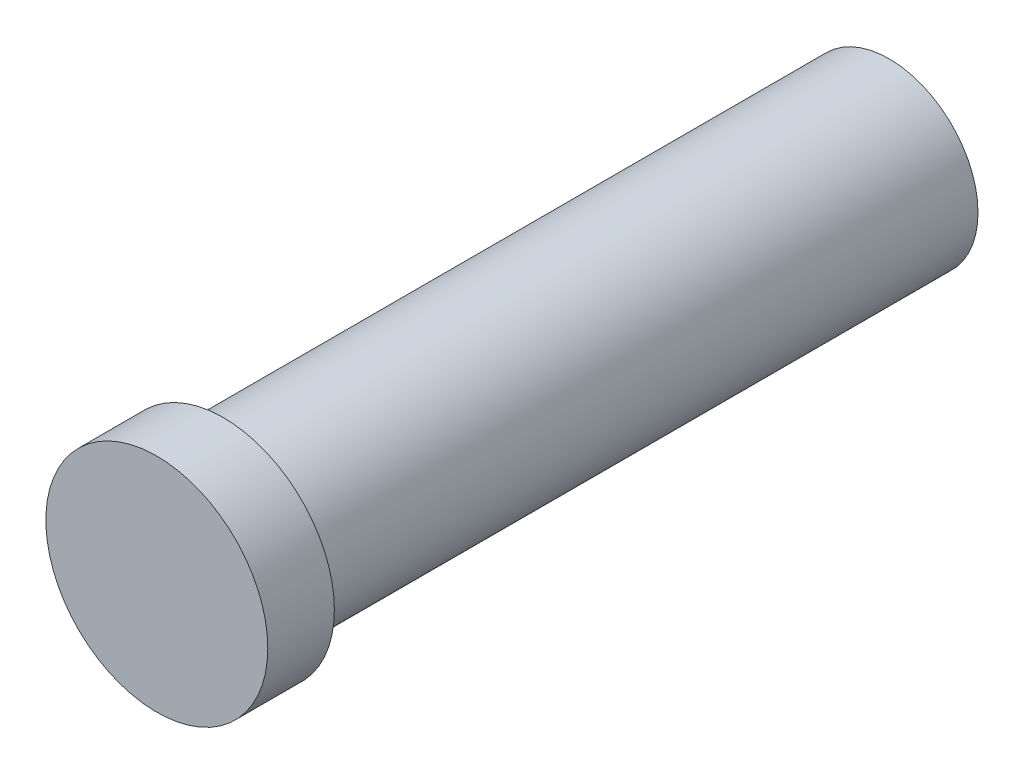
from build123d import *

# Parameters (mm, degrees)
SKIZZE1_R                       = 4
AUFSATZ_LINEAR_AUSTRAGEN1_DEPTH = 33
SKIZZE2_R                       = 5
AUFSATZ_LINEAR_AUSTRAGEN2_DEPTH = 3


with BuildPart() as part:
    # Skizze1 → Aufsatz-Linear austragen1 (new body)
    with BuildSketch(Plane.XY):
        Circle(SKIZZE1_R)
    extrude(amount=AUFSATZ_LINEAR_AUSTRAGEN1_DEPTH)

    # Skizze2 → Aufsatz-Linear austragen2 (add)
    with BuildSketch(Plane.XY.offset(33)):
        Circle(SKIZZE2_R)
    extrude(amount=-AUFSATZ_LINEAR_AUSTRAGEN2_DEPTH)


solid = part.part
